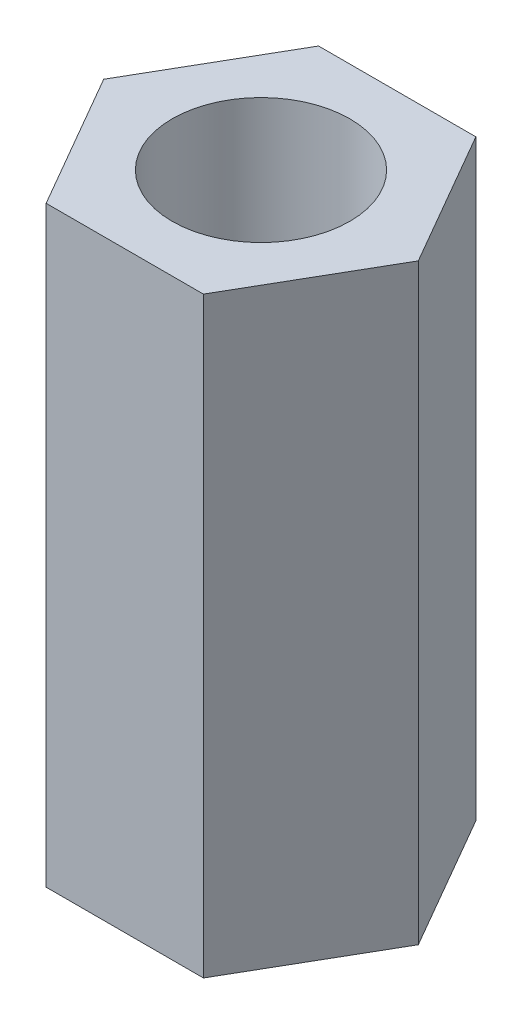
from build123d import *

# Parameters (mm, degrees)
SKETCH1_R           = 1.5
BOSS_EXTRUDE1_DEPTH = 10


with BuildPart() as part:
    # Sketch1 → Boss-Extrude1 (new body)
    with BuildSketch(Plane(origin=(0, 0, 0), x_dir=(1, 0, 0), z_dir=(0, 1, 0))):
        Polygon((1.327905619, -2.3), (2.655811238, 0), (1.327905619, 2.3), (-1.327905619, 2.3), (-2.655811238, 0), (-1.327905619, -2.3), align=None)
        with Locations(Location((0, 0, 0), (0, 0, 270))):
            Circle(SKETCH1_R, mode=Mode.SUBTRACT)
    extrude(amount=BOSS_EXTRUDE1_DEPTH)


solid = part.part
